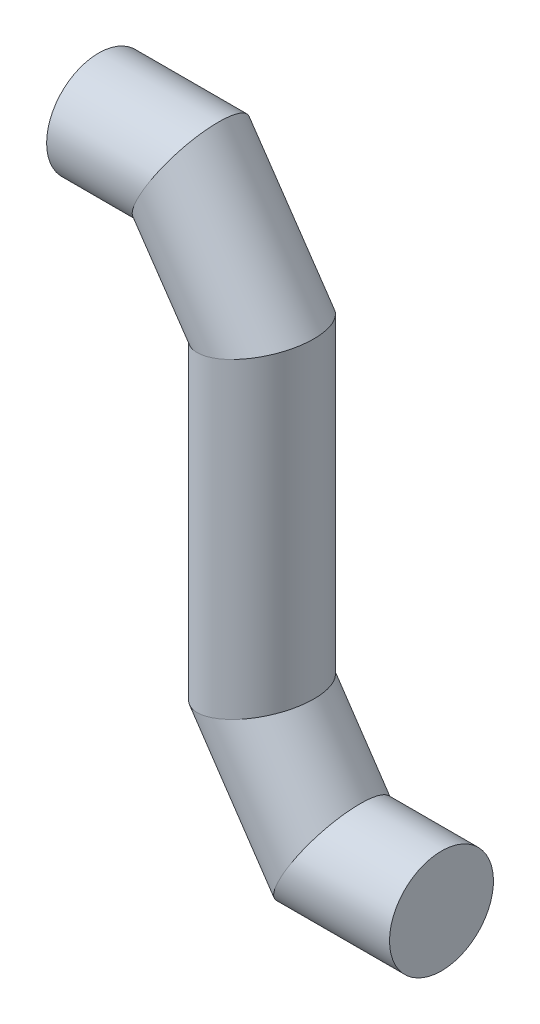
from build123d import *

# Parameters (mm, degrees)
SWEEP1_PROFILE_R = 5


with BuildPart() as part:
    # Sweep1: sweep along a path in Sketch1
    with BuildLine(Plane.XY) as sweep1_path:
        Line((-15.72815534, 25), (-6.844660194, 25))
        Line((-6.844660194, 25), (0, 15))
        Line((0, 15), (0, -15))
        Line((0, -15), (6.77184466, -25))
        Line((6.77184466, -25), (17.27184466, -25))
    # Sweep1 profile (on start of the path) → Sweep1 (sweep)
    with BuildSketch(Plane(origin=(-15.72815534, 25, 0), x_dir=(0, 0, 1), z_dir=(1, 0, 0))):
        Circle(SWEEP1_PROFILE_R)
    sweep(path=sweep1_path.line, transition=Transition.RIGHT)


solid = part.part
